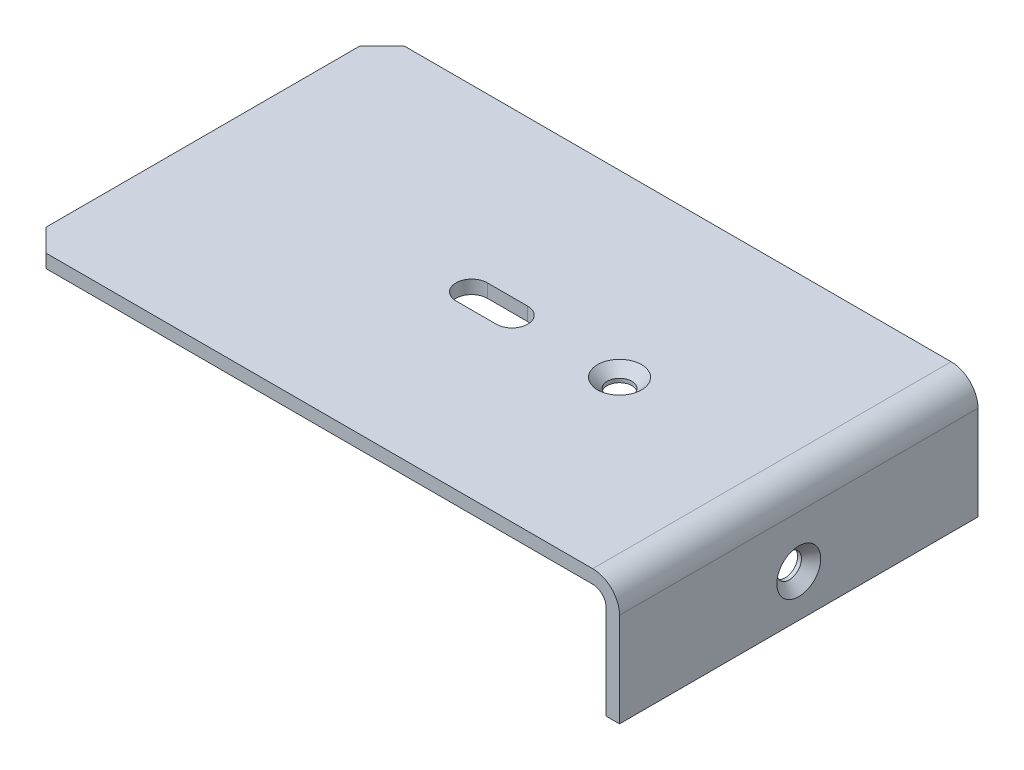
from build123d import *

# Parameters (mm, degrees)
BASE_EXTRU_MINCE_DEPTH  = 40
CHANFREIN1_SIZE         = 5
ESQUISSE3_R             = 2.75
ENL_V_MAT_EXTRU_1_DEPTH = 139.668669857
ESQUISSE4_R             = 2.75
ENL_V_MAT_EXTRU_2_DEPTH = 141.943250991
CHANFREIN2_SIZE         = 2.15


with BuildPart() as part:
    # Esquisse1 → Base-Extru.-Mince (new, symmetric)
    with BuildSketch(Plane.XY):
        with BuildLine():
            Line((0, -24), (0, -3))
            ThreePointArc((0, -3), (-0.878679656, -0.878679656), (-3, 0))
            Line((-3, 0), (-130, 0))
            Line((-130, 0), (-130, 3))
            Line((-130, 3), (-3, 3))
            ThreePointArc((-3, 3), (1.242640687, 1.242640687), (3, -3))
            Line((3, -3), (3, -24))
            Line((3, -24), (0, -24))
        make_face()
    extrude(amount=BASE_EXTRU_MINCE_DEPTH, both=True)

    # Chanfrein1
    chanfrein1_edges = [part.edges().sort_by_distance(p)[0] for p in [
        (-130, 1.5, -40),
        (-130, 1.5, 40),
    ]]
    chamfer(chanfrein1_edges, length=CHANFREIN1_SIZE)

    # Esquisse3 → Enlèv. mat.-Extru.1 (cut, through all)
    with BuildSketch(Plane(origin=(0, 3, 0), x_dir=(-1, 0, 0), z_dir=(0, 1, 0))):
        with Locations((37, 0)):
            Circle(ESQUISSE3_R)
        with BuildLine():
            Line((70, 3.5), (61, 3.5))
            ThreePointArc((61, 3.5), (57.5, 0), (61, -3.5))
            Line((61, -3.5), (70, -3.5))
            ThreePointArc((70, -3.5), (73.5, 0), (70, 3.5))
        make_face()
    extrude(amount=-ENL_V_MAT_EXTRU_1_DEPTH, mode=Mode.SUBTRACT)

    # Esquisse4 → Enlèv. mat.-Extru.2 (cut, through all)
    with BuildSketch(Plane(origin=(3, 0, 0), x_dir=(0, 0, -1), z_dir=(1, 0, 0))):
        with Locations((0, -14.5)):
            Circle(ESQUISSE4_R)
    extrude(amount=-ENL_V_MAT_EXTRU_2_DEPTH, mode=Mode.SUBTRACT)

    # Chanfrein2
    chanfrein2_edges = [part.edges().sort_by_distance(p)[0] for p in [
        (-34.25, 3, 0),
        (3, -14.5, 2.75),
    ]]
    chamfer(chanfrein2_edges, length=CHANFREIN2_SIZE)


solid = part.part
